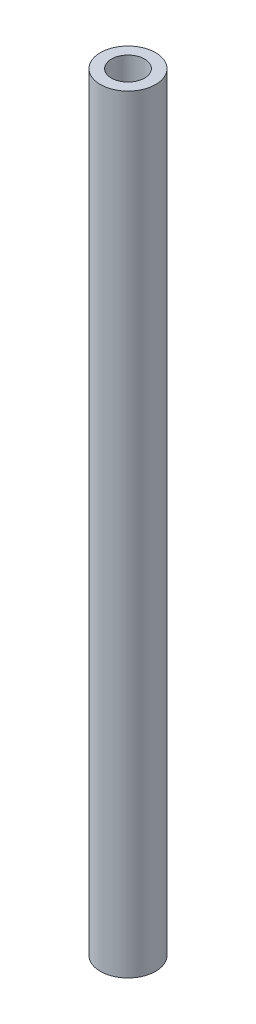
from build123d import *

# Parameters (mm, degrees)
SKETCH1_R                      = 0.5
BOSS_EXTRUDE1_DEPTH            = 13.9
F_0_4_0_4_DIAMETER_HOLE1_D     = 0.4
F_0_6_0_6_DIAMETER_HOLE1_D     = 0.6
F_0_6_0_6_DIAMETER_HOLE1_DEPTH = 3
F_0_6_0_6_DIAMETER_HOLE1_TIP   = 0.180258186
F_0_6_0_6_DIAMETER_HOLE2_D     = 0.6
F_0_6_0_6_DIAMETER_HOLE2_DEPTH = 3
F_0_6_0_6_DIAMETER_HOLE2_TIP   = 0.180258186


with BuildPart() as part:
    # Sketch1 → Boss-Extrude1 (new body)
    with BuildSketch(Plane(origin=(0, 0, 0), x_dir=(1, 0, 0), z_dir=(0, 1, 0))):
        with Locations(Location((0, 0, 0), (0, 0, 270))):
            Circle(SKETCH1_R)
    extrude(amount=BOSS_EXTRUDE1_DEPTH)

    # Ø0.4 (0.4) Diameter Hole1 (through all)
    with Locations(Plane(origin=(0, 13.9, 0), x_dir=(-1, 0, 0), z_dir=(0, 1, 0))):
        with Locations((0, 0)):
            Hole(F_0_4_0_4_DIAMETER_HOLE1_D / 2)

    # Ø0.6 (0.6) Diameter Hole1
    with Locations(Plane(origin=(0, 13.9, 0), x_dir=(-1, 0, 0), z_dir=(0, 1, 0))):
        with Locations((0, 0)):
            Hole(F_0_6_0_6_DIAMETER_HOLE1_D / 2, depth=F_0_6_0_6_DIAMETER_HOLE1_DEPTH)
            with Locations((0, 0, -(F_0_6_0_6_DIAMETER_HOLE1_DEPTH + F_0_6_0_6_DIAMETER_HOLE1_TIP / 2))):  # 118° drill point
                Cone(0, F_0_6_0_6_DIAMETER_HOLE1_D / 2, F_0_6_0_6_DIAMETER_HOLE1_TIP, mode=Mode.SUBTRACT)

    # Ø0.6 (0.6) Diameter Hole2
    with Locations(Plane.XZ):
        with Locations((0, 0)):
            Hole(F_0_6_0_6_DIAMETER_HOLE2_D / 2, depth=F_0_6_0_6_DIAMETER_HOLE2_DEPTH)
            with Locations((0, 0, -(F_0_6_0_6_DIAMETER_HOLE2_DEPTH + F_0_6_0_6_DIAMETER_HOLE2_TIP / 2))):  # 118° drill point
                Cone(0, F_0_6_0_6_DIAMETER_HOLE2_D / 2, F_0_6_0_6_DIAMETER_HOLE2_TIP, mode=Mode.SUBTRACT)


solid = part.part
